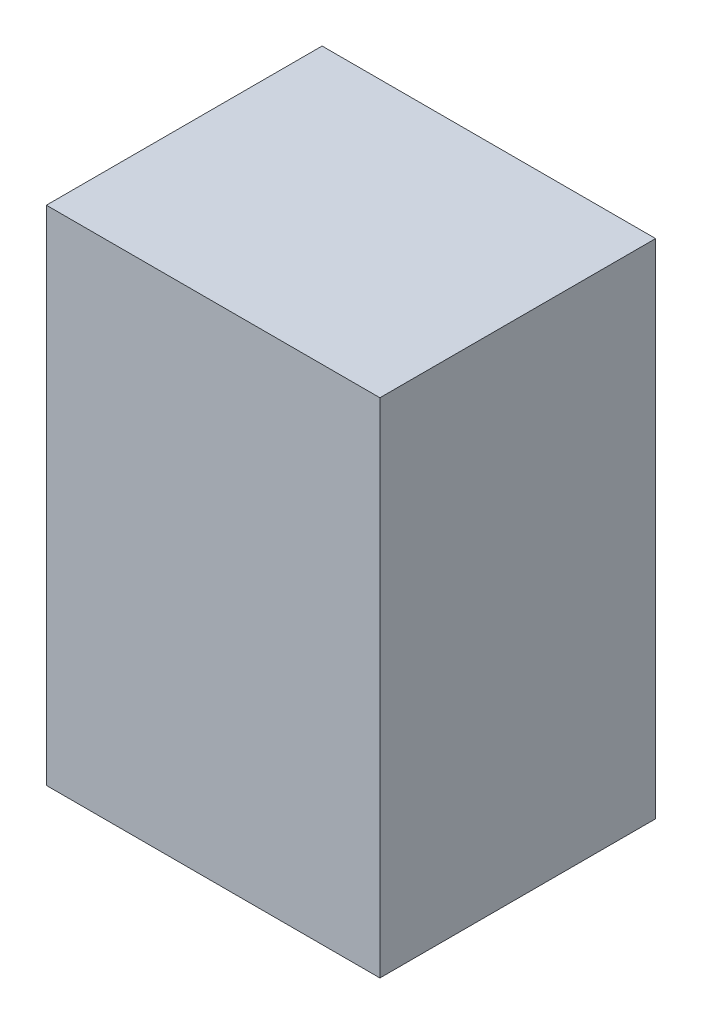
from build123d import *

# Parameters (mm, degrees)
SKIZZE1_W                       = 113
SKIZZE1_H                       = 75
AUFSATZ_LINEAR_AUSTRAGEN1_DEPTH = 62


with BuildPart() as part:
    # Skizze1 → Aufsatz-Linear austragen1 (new body)
    with BuildSketch(Plane(origin=(0, 0, 0), x_dir=(0, 1, 0), z_dir=(0, 0, 1))):
        Rectangle(SKIZZE1_W, SKIZZE1_H)
    extrude(amount=AUFSATZ_LINEAR_AUSTRAGEN1_DEPTH)


solid = part.part
